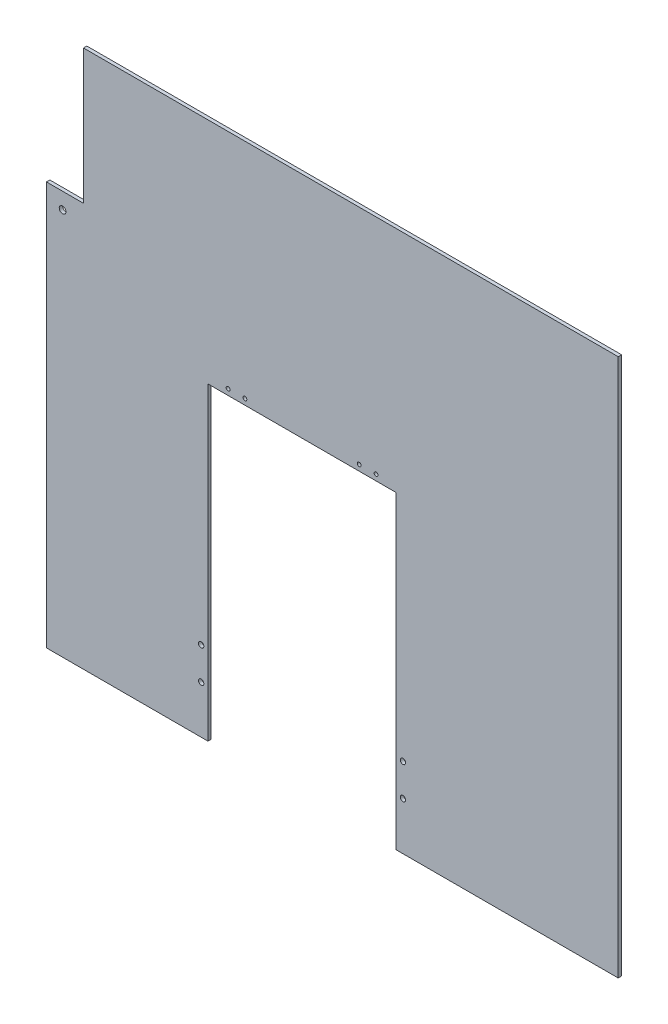
from build123d import *

# Parameters (mm, degrees)
SKETCH1_W           = 539.75
SKETCH1_H           = 508
BOSS_EXTRUDE1_DEPTH = 3.175
SKETCH2_R           = 2.54
SKETCH2_R_2         = 3.175
SKETCH2_W           = 177.8
SKETCH2_H           = 292.1
CUT_EXTRUDE1_DEPTH  = 44.45
SKETCH3_W           = 34.925
SKETCH3_H           = 127
CUT_EXTRUDE2_DEPTH  = 742.218013222
SKETCH4_R           = 1.8034
CUT_EXTRUDE3_DEPTH  = 742.218013222
SKETCH5_R           = 2.54
CUT_EXTRUDE4_DEPTH  = 742.218013222
SKETCH6_R           = 2.54
CUT_EXTRUDE5_DEPTH  = 742.218013222


with BuildPart() as part:
    # Sketch1 → Boss-Extrude1 (new body)
    with BuildSketch(Plane.XY):
        with Locations((269.875, 254)):
            Rectangle(SKETCH1_W, SKETCH1_H)
    extrude(amount=BOSS_EXTRUDE1_DEPTH)

    # Sketch2 → Cut-Extrude1 (cut)
    with BuildSketch(Plane(origin=(0, 0, 0), x_dir=(-1, 0, 0), z_dir=(0, 0, -1))):
        with Locations((-336.55, 45.085)):
            Circle(SKETCH2_R)
        with Locations((-146.05, 45.085)):
            Circle(SKETCH2_R)
        with Locations((-15.24, 365.76)):
            Circle(SKETCH2_R_2)
        with Locations((-241.3, 146.05)):
            Rectangle(SKETCH2_W, SKETCH2_H)
    extrude(amount=-CUT_EXTRUDE1_DEPTH, mode=Mode.SUBTRACT)

    # Sketch3 → Cut-Extrude2 (cut, through all)
    with BuildSketch(Plane(origin=(0, 0, 0), x_dir=(-1, 0, 0), z_dir=(0, 0, -1))):
        with Locations((-17.4625, 444.5)):
            Rectangle(SKETCH3_W, SKETCH3_H)
    extrude(amount=-CUT_EXTRUDE2_DEPTH, mode=Mode.SUBTRACT)

    # Sketch4 → Cut-Extrude3 (cut, through all)
    with BuildSketch(Plane(origin=(0, 0, 0), x_dir=(-1, 0, 0), z_dir=(0, 0, -1))):
        with Locations((-311.1754, 297.6372)):
            Circle(SKETCH4_R)
        with Locations((-295.3004, 297.6372)):
            Circle(SKETCH4_R)
        with Locations((-187.3504, 297.6372)):
            Circle(SKETCH4_R)
        with Locations((-171.4754, 297.6372)):
            Circle(SKETCH4_R)
    extrude(amount=-CUT_EXTRUDE3_DEPTH, mode=Mode.SUBTRACT)

    # Sketch5 → Cut-Extrude4 (cut, through all)
    with BuildSketch(Plane.XY.offset(3.175)):
        with Locations((146.05, 75.565)):
            Circle(SKETCH5_R)
    extrude(amount=-CUT_EXTRUDE4_DEPTH, mode=Mode.SUBTRACT)

    # Sketch6 → Cut-Extrude5 (cut, through all)
    with BuildSketch(Plane.XY.offset(3.175)):
        with Locations((336.55, 75.565)):
            Circle(SKETCH6_R)
    extrude(amount=-CUT_EXTRUDE5_DEPTH, mode=Mode.SUBTRACT)


solid = part.part
